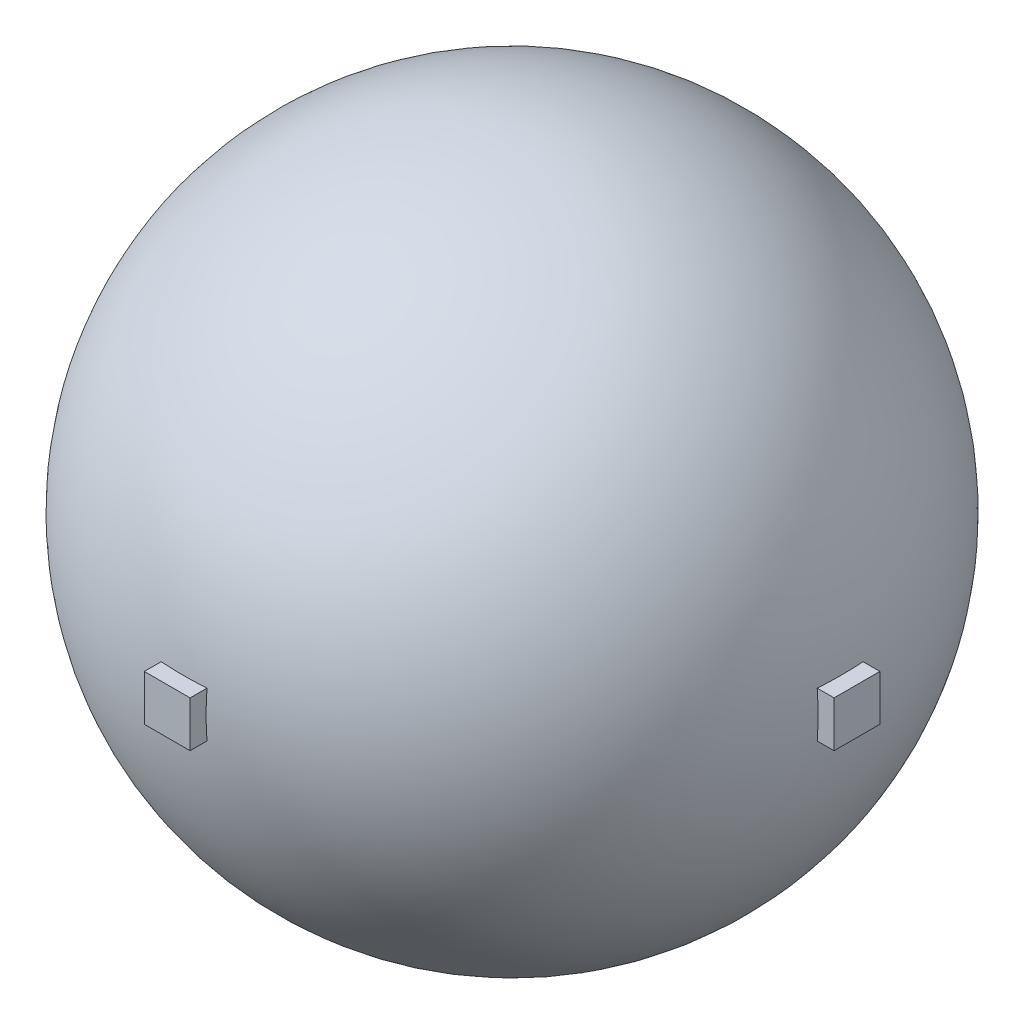
from build123d import *

# Parameters (mm, degrees)
SHELL1_T                 = 3.175
BOSS_EXTRUDE2_REACH      = 684.353
BOSS_EXTRUDE2_END_RADIUS = 274.32
SKETCH4_W                = 38.1
SKETCH4_H                = 38.1
CIRPATTERN2_COUNT        = 4


with BuildPart() as part:
    # Sketch1 → Revolve6 (revolve)
    with BuildSketch(Plane(origin=(0, 0, 0), x_dir=(1, 0, 0), z_dir=(0, 1, 0))):
        with BuildLine():
            Line((-274.32, 0), (274.32, 0))
            ThreePointArc((274.32, 0), (0, 274.32), (-274.32, 0))
        make_face()
    revolve(axis=Axis((-274.32, 0, 0), (1, 0, 0)))

    # Shell1 (no face opened: a closed hollow body)
    add(offset(amount=-SHELL1_T, mode=Mode.PRIVATE), mode=Mode.SUBTRACT)

    # Boss-Extrude2: up to this sphere (the profile starts outside it)
    boss_extrude2_end = Location((0, 0, 0)) * Sphere(BOSS_EXTRUDE2_END_RADIUS, mode=Mode.PRIVATE)
    # Sketch4 → Boss-Extrude2 (add, up to the surface)
    with BuildSketch(Plane.XY.offset(287.02), mode=Mode.PRIVATE) as boss_extrude2_sk1:
        Rectangle(SKETCH4_W, SKETCH4_H)
    boss_extrude2_tool1 = extrude(boss_extrude2_sk1.sketch, amount=-BOSS_EXTRUDE2_REACH, mode=Mode.PRIVATE) - boss_extrude2_end
    boss_extrude2 = boss_extrude2_tool1.solids().sort_by_distance((0, 0, 287.02))[0]
    add(boss_extrude2)

    # CirPattern2: Boss-Extrude2 ×4 about axis
    cirpattern2_axis = Axis((0, 0, 0), (0, 1, 0))
    for i in range(1, CIRPATTERN2_COUNT):
        add(boss_extrude2.rotate(cirpattern2_axis, i * 360 / CIRPATTERN2_COUNT))


solid = part.part
